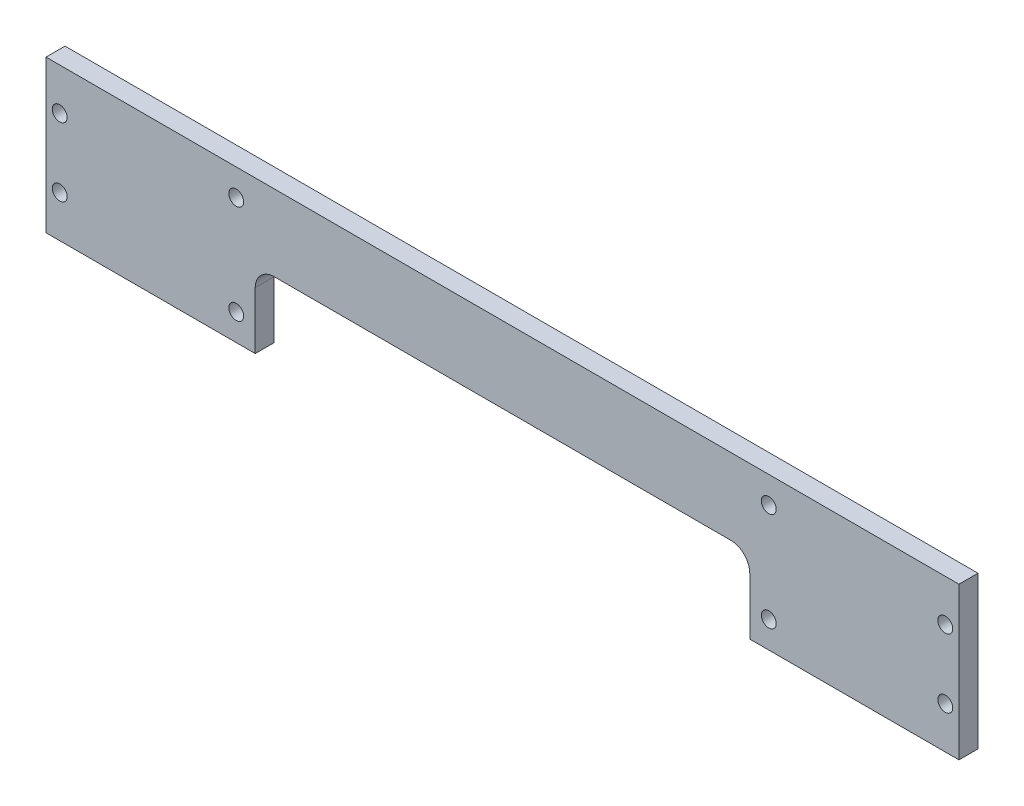
from build123d import *

# Parameters (mm, degrees)
SKETCH1_W           = 304.8
SKETCH1_H           = 50.8
SKETCH1_R           = 2.4892
BOSS_EXTRUDE1_DEPTH = 6.35
SKETCH3_W           = 165.1
SKETCH3_H           = 25.4
CUT_EXTRUDE1_DEPTH  = 155.632604906
FILLET1_R           = 6.35


with BuildPart() as part:
    # Sketch1 → Boss-Extrude1 (new body)
    with BuildSketch(Plane.XY):
        Rectangle(SKETCH1_W, SKETCH1_H)
        with Locations((-88.9, 16.51)):
            Circle(SKETCH1_R, mode=Mode.SUBTRACT)
        with Locations((-88.9, -16.51)):
            Circle(SKETCH1_R, mode=Mode.SUBTRACT)
        with Locations((88.9, -16.51)):
            Circle(SKETCH1_R, mode=Mode.SUBTRACT)
        with Locations((88.9, 16.51)):
            Circle(SKETCH1_R, mode=Mode.SUBTRACT)
        with Locations((-147.828, 11.43)):
            Circle(SKETCH1_R, mode=Mode.SUBTRACT)
        with Locations((-147.828, -11.43)):
            Circle(SKETCH1_R, mode=Mode.SUBTRACT)
        with Locations((147.828, 11.43)):
            Circle(SKETCH1_R, mode=Mode.SUBTRACT)
        with Locations((147.828, -11.43)):
            Circle(SKETCH1_R, mode=Mode.SUBTRACT)
    extrude(amount=BOSS_EXTRUDE1_DEPTH)

    # Sketch3 → Cut-Extrude1 (cut, through all)
    with BuildSketch(Plane.XY.offset(6.35)):
        with Locations((0, -12.7)):
            Rectangle(SKETCH3_W, SKETCH3_H)
    extrude(amount=-CUT_EXTRUDE1_DEPTH, mode=Mode.SUBTRACT)

    # Fillet1
    fillet1_edges = [part.edges().sort_by_distance(p)[0] for p in [
        (-82.55, 0, 3.175),
        (82.55, 0, 3.175),
    ]]
    fillet(fillet1_edges, radius=FILLET1_R)


solid = part.part
